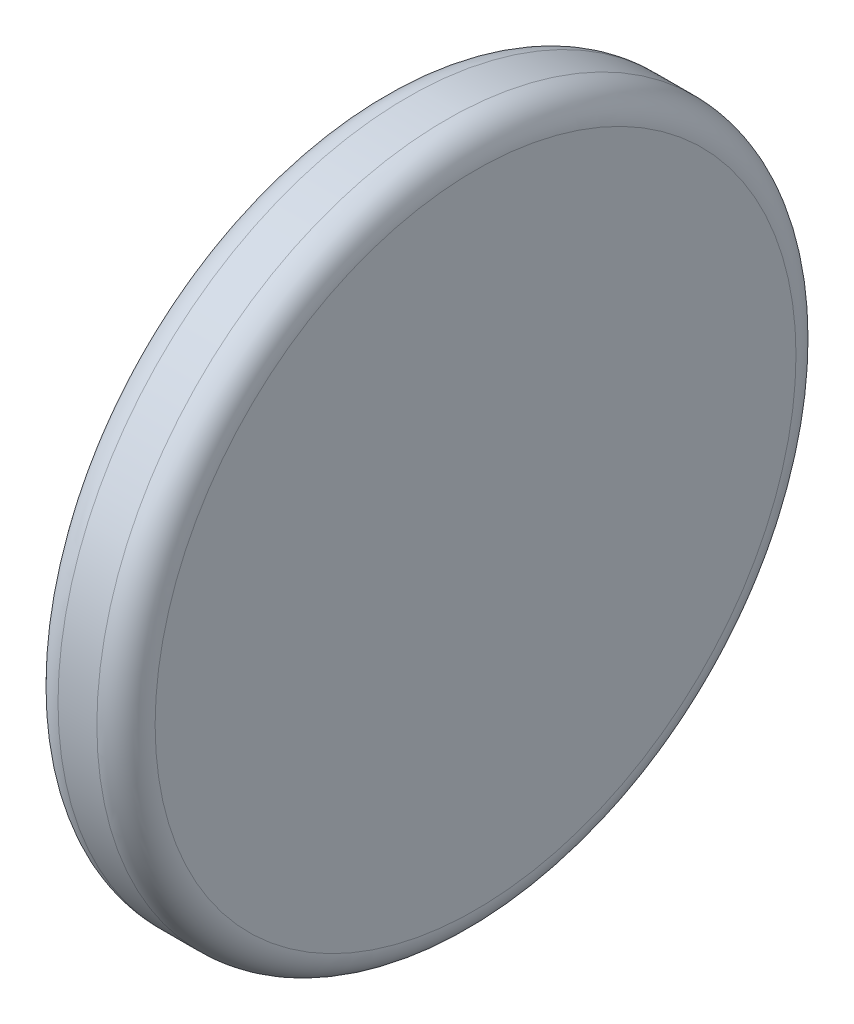
from build123d import *

# Parameters (mm, degrees)
SKETCH1_W = 10
SKETCH1_H = 36
FILLET2_R = 3


with BuildPart() as part:
    # Sketch1 → Revolve1 (revolve)
    with BuildSketch(Plane.XY, mode=Mode.PRIVATE) as revolve1_sk:
        with Locations((5, 18)):
            Rectangle(SKETCH1_W, SKETCH1_H)
    revolve(revolve1_sk.sketch.rotate(Axis((0, 0, 0), (1, 0, 0)), 90), axis=Axis((0, 0, 0), (1, 0, 0)))

    # Fillet2
    fillet2_edges = [part.edges().sort_by_distance(p)[0] for p in [
        (10, 0, -36),
        (0, 0, -36),
    ]]
    fillet(fillet2_edges, radius=FILLET2_R)


solid = part.part
